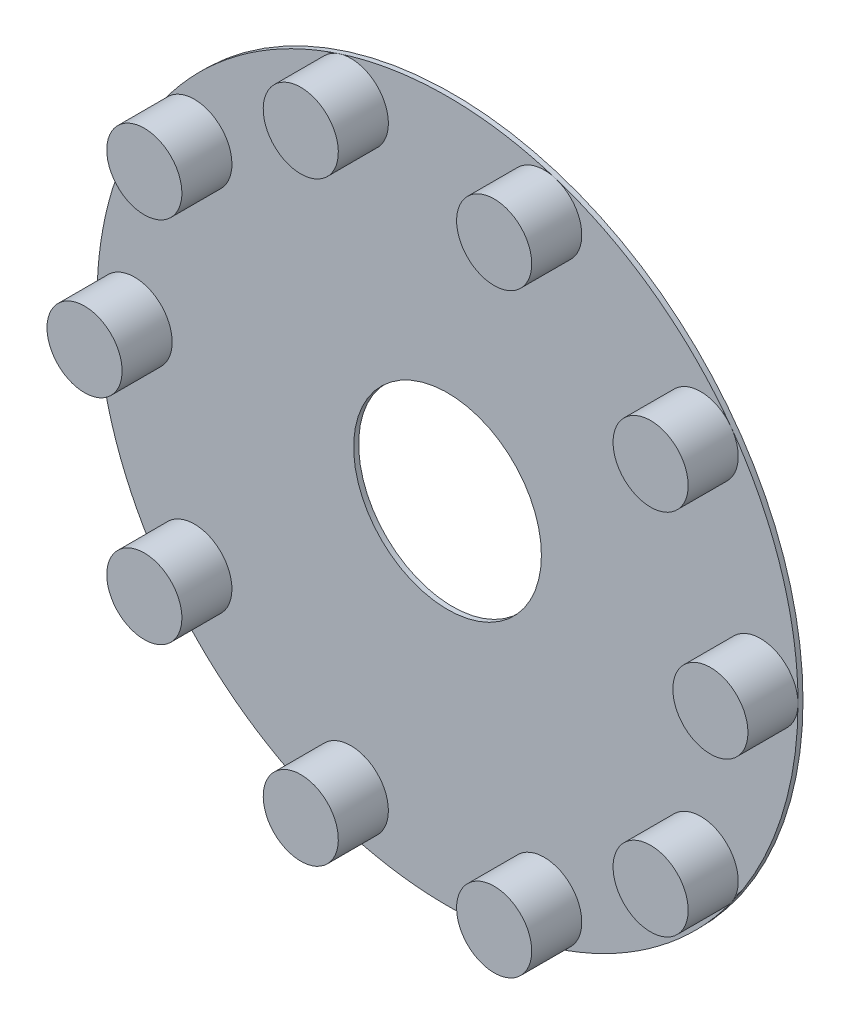
from build123d import *

# Parameters (mm, degrees)
PINSBASEEXTRUDE_DEPTH      = 0.2
PINSBASEEXTRUDE_DEPTH_BACK = 0.2
PINSBASESKETCH_R           = 28
PINSEXTRUDE_START          = -0.2
PINSSKETCH_R               = 3
PINSEXTRUDE_DEPTH          = 4.4
PINSPATTERN_COUNT          = 10
BOREREVOLVESKETCH_W        = 4
BOREREVOLVESKETCH_H        = 7.5


with BuildPart() as part:
    # PinsBaseSketch → PinsBaseExtrude (new, two sides: drawn at the far end of the back side and taken through both)
    with BuildSketch(Plane.XY.offset(-PINSBASEEXTRUDE_DEPTH_BACK)):
        Circle(PINSBASESKETCH_R)
    extrude(amount=PINSBASEEXTRUDE_DEPTH + PINSBASEEXTRUDE_DEPTH_BACK)

    # PinsSketch → PinsExtrude (add)
    with BuildSketch(Plane.XY.offset(PINSEXTRUDE_START)):
        with Locations((25, 0)):
            Circle(PINSSKETCH_R)
    pinsextrude = extrude(amount=PINSEXTRUDE_DEPTH)

    # PinsPattern: PinsExtrude ×10 about axis
    pinspattern_axis = Axis((0, 0, 55), (0, 0, -1))
    for i in range(1, PINSPATTERN_COUNT):
        add(pinsextrude.rotate(pinspattern_axis, i * 360 / PINSPATTERN_COUNT))

    # BoreRevolveSketch → BoreRevolveCut (revolve, cut)
    with BuildSketch(Plane(origin=(0, 0, 0), x_dir=(0, 0, -1), z_dir=(1, 0, 0))):
        with Locations((0, 3.75)):
            Rectangle(BOREREVOLVESKETCH_W, BOREREVOLVESKETCH_H)
    revolve(axis=Axis((0, 0, 0), (0, 0, -1)), mode=Mode.SUBTRACT)


solid = part.part
